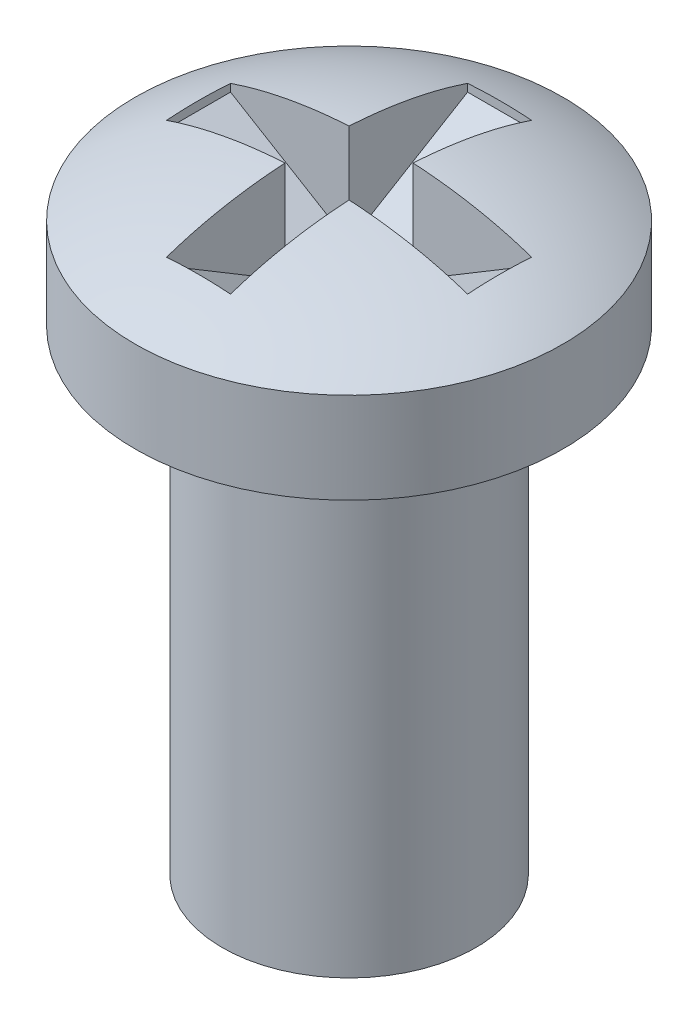
from build123d import *

# Parameters (mm, degrees)
SKETCH_3_W               = 0.404003898
SKETCH_3_H               = 0.95
CUT_EXTRUDE_1_DEPTH      = 0.2
PATTERN_CIRCULAR_4_COUNT = 4
CUT_EXTRUDE_4_DEPTH      = 0.404003899
CUT_EXTRUDE_5_DEPTH      = 0.404003899
SKETCH_8_W               = 0.404003898
SKETCH_8_H               = 0.404003898
EXTRUDE_1_DEPTH          = 0.3


with BuildPart() as part:
    # 草图2 → 旋转1 (revolve)
    with BuildSketch(Plane.XY, mode=Mode.PRIVATE) as revolve_1_sk:
        with BuildLine():
            Line((1.35, -0.326458657), (1.35, -0.9))
            Line((1.35, -0.9), (0.8, -0.9))
            Line((0.8, -0.9), (0.8, -3.9))
            Line((0.8, -3.9), (0, -3.9))
            Line((0, -3.9), (0, 0))
            add(Edge.make_bspline(
                [(0, 0), (0.463191953, 0), (0.947298492, -0.088866646), (1.35, -0.326458657)],
                knots=[0, 0, 0, 0, 1, 1, 1, 1], degree=3))
        make_face()
    revolve(revolve_1_sk.sketch.rotate(Axis((0, 0, 0), (0, -1, 0)), 180), axis=Axis((0, 0, 0), (0, -1, 0)))

    # 草图3 → 切除-拉伸1 (cut)
    with BuildSketch(Plane(origin=(0, 0, 0), x_dir=(-1, 0, 0), z_dir=(0, -1, 0))):
        with Locations((0, 0.475)):
            Rectangle(SKETCH_3_W, SKETCH_3_H)
    cut_extrude_1 = extrude(amount=CUT_EXTRUDE_1_DEPTH, mode=Mode.SUBTRACT)

    # 阵列(圆周)4: 切除-拉伸1 ×4 about axis
    pattern_circular_4_axis = Axis((0, 0, 0), (0, 1, 0))
    for i in range(1, PATTERN_CIRCULAR_4_COUNT):
        add(cut_extrude_1.rotate(pattern_circular_4_axis, i * 360 / PATTERN_CIRCULAR_4_COUNT), mode=Mode.SUBTRACT)

    # 草图6 → 切除-拉伸4 (cut)
    with BuildSketch(Plane(origin=(0, 0, 0.202001949), x_dir=(-1, 0, 0), z_dir=(0, 0, -1))):
        Polygon((0.95, -0.2), (0, -0.770817588), (-0.95, -0.2), align=None)
    extrude(amount=CUT_EXTRUDE_4_DEPTH, mode=Mode.SUBTRACT)

    # 草图7 → 切除-拉伸5 (cut)
    with BuildSketch(Plane.ZY.offset(-0.202001949)):
        Polygon((0.95, -0.2), (0, -0.770817588), (-0.95, -0.2), align=None)
    extrude(amount=CUT_EXTRUDE_5_DEPTH, mode=Mode.SUBTRACT)

    # 草图8 → 凸台-拉伸1 (add)
    with BuildSketch(Plane(origin=(0, -0.649442572, 0), x_dir=(-1, 0, 0), z_dir=(0, -1, 0))):
        Rectangle(SKETCH_8_W, SKETCH_8_H)
    extrude(amount=EXTRUDE_1_DEPTH)


solid = part.part
